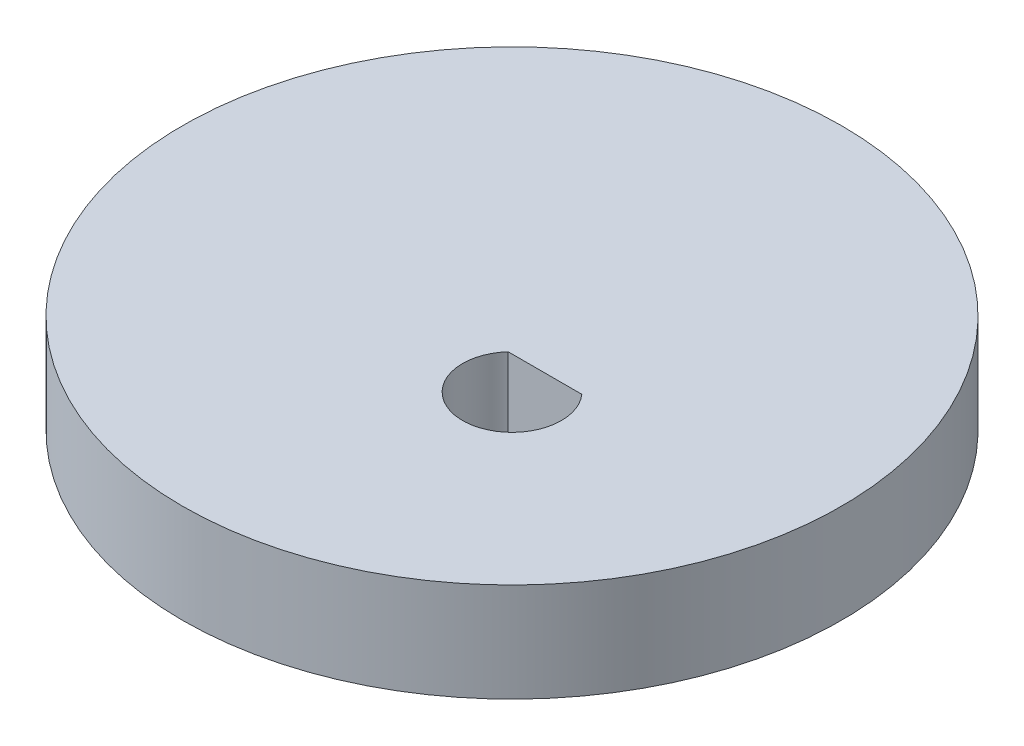
from build123d import *

# Parameters (mm, degrees)
SKETCH1_R           = 10
BOSS_EXTRUDE1_DEPTH = 3
CUT_EXTRUDE2_DEPTH  = 3


with BuildPart() as part:
    # Sketch1 → Boss-Extrude1 (new body)
    with BuildSketch(Plane(origin=(0, 0, 0), x_dir=(1, 0, 0), z_dir=(0, 1, 0))):
        with Locations(Location((0, 0, 0), (0, 0, 270))):
            Circle(SKETCH1_R)
    extrude(amount=BOSS_EXTRUDE1_DEPTH)

    # Sketch6 → Cut-Extrude2 (cut)
    with BuildSketch(Plane(origin=(0, 3, 0), x_dir=(1, 0, 0), z_dir=(0, 1, 0))):
        with BuildLine():
            Line((0.881966011, -1), (3.118033989, -1))
            ThreePointArc((3.118033989, -1), (2, -3.5), (0.881966011, -1))
        make_face()
    extrude(amount=-CUT_EXTRUDE2_DEPTH, mode=Mode.SUBTRACT)


solid = part.part
